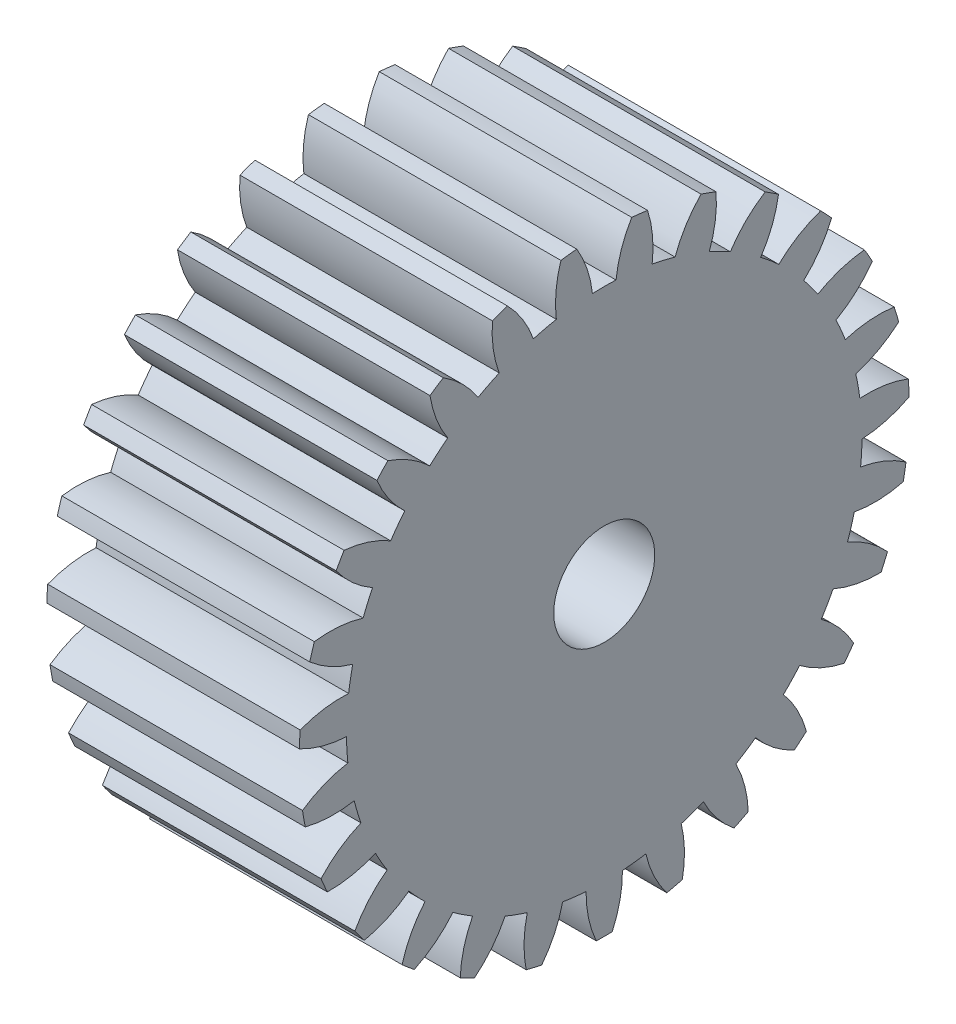
from build123d import *

# Parameters (mm, degrees)
BASPROSKE_W     = 30
BASPROSKE_H     = 36.25
TOOTHCUT_DEPTH  = 60.398021853
TEETHCUTS_COUNT = 27
TEETHCUTS_ANGLE = 346.666666667
BORSKE_R        = 6
BORE_DEPTH      = 50.0000508


with BuildPart() as part:
    # BasProSke → Base-Revolve (revolve)
    with BuildSketch(Plane(origin=(0, 0, 0), x_dir=(1, 0, 0), z_dir=(0, 1, 0)), mode=Mode.PRIVATE) as base_revolve_sk:
        with Locations((15, 18.125)):
            Rectangle(BASPROSKE_W, BASPROSKE_H)
    revolve(base_revolve_sk.sketch.rotate(Axis((-10, 0, 0), (1, 0, 0)), 180), axis=Axis((-10, 0, 0), (1, 0, 0)))

    # TooCutSke → ToothCut (cut, through all)
    with BuildSketch(Plane(origin=(0, 0, 0), x_dir=(0, 0, -1), z_dir=(1, 0, 0))):
        with BuildLine():
            ThreePointArc((1.400501142, 30.591959279), (0, 30.624), (-1.400501142, 30.591959279))
            ThreePointArc((-1.400501142, 30.591959279), (-2.037265542, 33.46233268), (-3.280347415, 36.126776302))
            ThreePointArc((-3.280347415, 36.126776302), (0, 36.2754), (3.280347415, 36.126776302))
            ThreePointArc((3.280347415, 36.126776302), (2.037265542, 33.46233268), (1.400501142, 30.591959279))
        make_face()
    toothcut = extrude(amount=TOOTHCUT_DEPTH, mode=Mode.SUBTRACT)

    # TeethCuts: ToothCut ×27 about axis
    teethcuts_axis = Axis((-10, 0, 0), (1, 0, 0))
    for i in range(1, TEETHCUTS_COUNT):
        add(toothcut.rotate(teethcuts_axis, i * TEETHCUTS_ANGLE / (TEETHCUTS_COUNT - 1)), mode=Mode.SUBTRACT)

    # BorSke → Bore (cut, symmetric)
    with BuildSketch(Plane(origin=(0, 0, 0), x_dir=(0, 0, -1), z_dir=(1, 0, 0))):
        with Locations(Location((0, 0, 0), (0, 0, 180))):
            Circle(BORSKE_R)
    extrude(amount=BORE_DEPTH, both=True, mode=Mode.SUBTRACT)


solid = part.part
